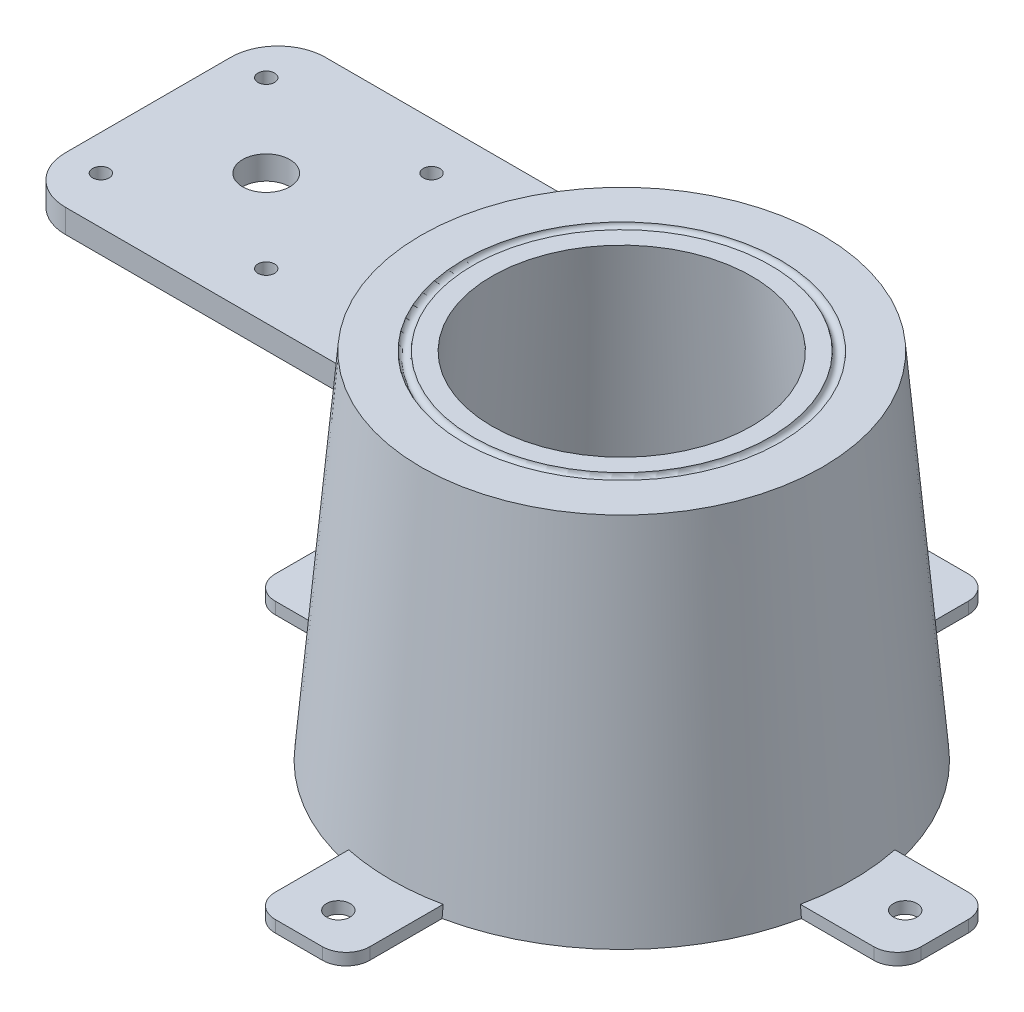
from build123d import *

# Parameters (mm, degrees)
SKETCH1_R            = 85
BOSS_EXTRUDE1_DEPTH  = 150
BOSS_EXTRUDE1_DRAFT  = 5
CUT_SWEEP1_PROFILE_R = 2
SKETCH11_R           = 55
CUT_EXTRUDE1_DEPTH   = 150
CUT_EXTRUDE1_DRAFT   = 5
BOSS_EXTRUDE2_START  = -10
SKETCH13_W           = 140
SKETCH13_H           = 110
BOSS_EXTRUDE2_DEPTH  = 10
SKETCH14_R           = 10
CUT_EXTRUDE2_DEPTH   = 10
FILLET3_R            = 20
SKETCH15_R           = 3.5
CUT_EXTRUDE3_DEPTH   = 10
SKETCH17_R           = 5
BOSS_EXTRUDE3_DEPTH  = 5
CIRPATTERN1_COUNT    = 4


with BuildPart() as part:
    # Sketch1 → Boss-Extrude1 (with draft: the straight prism first)
    with BuildSketch(Plane(origin=(0, 0, 0), x_dir=(1, 0, 0), z_dir=(0, 1, 0))):
        Circle(SKETCH1_R)
    extrude(amount=-BOSS_EXTRUDE1_DEPTH)
    # Boss-Extrude1: the draft: its side faces are tilted about the plane it starts from
    boss_extrude1_sides = [part.faces().sort_by_distance(p)[0] for p in [
        (-85, -75, 0),
    ]]
    draft(boss_extrude1_sides, Plane(origin=(0, 0, 0), x_dir=(1, 0, 0), z_dir=(0, 1, 0)), BOSS_EXTRUDE1_DRAFT)

    # Cut-Sweep1: sweep along a path in Sketch2
    with BuildLine(Plane(origin=(0, 0, 0), x_dir=(1, 0, 0), z_dir=(0, 1, 0))) as cut_sweep1_path:
        CenterArc((0, 0), 65, 0, 360)
    # Cut-Sweep1 profile (on start of the path) → Cut-Sweep1 (sweep, cut)
    with BuildSketch(Plane(origin=(65, 0, 0), x_dir=(-1, 0, 0), z_dir=(0, 0, -1))):
        Circle(CUT_SWEEP1_PROFILE_R)
    sweep(path=cut_sweep1_path.line, mode=Mode.SUBTRACT)


with BuildPart() as cut_extrude1_tool:
    # Sketch11 → Cut-Extrude1 (with draft: the straight prism first)
    with BuildSketch(Plane(origin=(0, 0, 0), x_dir=(1, 0, 0), z_dir=(0, 1, 0))):
        Circle(SKETCH11_R)
    extrude(amount=-CUT_EXTRUDE1_DEPTH)
    # Cut-Extrude1: the draft: its side faces are tilted about the plane it starts from
    cut_extrude1_sides = [cut_extrude1_tool.faces().sort_by_distance(p)[0] for p in [
        (-55, -75, 0),
    ]]
    draft(cut_extrude1_sides, Plane(origin=(0, 0, 0), x_dir=(1, 0, 0), z_dir=(0, 1, 0)), CUT_EXTRUDE1_DRAFT)


with BuildPart() as part_1:
    add(part.part)

    # Cut-Extrude1: cut by cut_extrude1_tool
    add(cut_extrude1_tool.part, mode=Mode.SUBTRACT)

    # Sketch13 → Boss-Extrude2 (add)
    with BuildSketch(Plane(origin=(0, 0, 0), x_dir=(1, 0, 0), z_dir=(0, 1, 0)).offset(BOSS_EXTRUDE2_START)):
        with Locations((-130.53, 0)):
            Rectangle(SKETCH13_W, SKETCH13_H)
    extrude(amount=-BOSS_EXTRUDE2_DEPTH)

    # Sketch14 → Cut-Extrude2 (cut)
    with BuildSketch(Plane(origin=(0, -10, 0), x_dir=(1, 0, 0), z_dir=(0, 1, 0))):
        with Locations(Location((-150.53, 0, 0), (0, 0, 270))):
            Circle(SKETCH14_R)
    extrude(amount=-CUT_EXTRUDE2_DEPTH, mode=Mode.SUBTRACT)

    # Fillet3
    fillet3_edges = [part_1.edges().sort_by_distance(p)[0] for p in [
        (-200.53, -15, 55),
        (-200.53, -15, -55),
    ]]
    fillet(fillet3_edges, radius=FILLET3_R)

    # Sketch15 → Cut-Extrude3 (cut)
    with BuildSketch(Plane(origin=(0, -10, 0), x_dir=(1, 0, 0), z_dir=(0, 1, 0))):
        with Locations(Location((-185.53, 35, 0), (0, 0, 270))):
            Circle(SKETCH15_R)
        with Locations(Location((-115.53, 35, 0), (0, 0, 270))):
            Circle(SKETCH15_R)
        with Locations(Location((-115.53, -35, 0), (0, 0, 270))):
            Circle(SKETCH15_R)
        with Locations(Location((-185.53, -35, 0), (0, 0, 270))):
            Circle(SKETCH15_R)
    extrude(amount=-CUT_EXTRUDE3_DEPTH, mode=Mode.SUBTRACT)

    # Sketch17 → Boss-Extrude3 (add)
    with BuildSketch(Plane.XZ.offset(150)):
        with BuildLine():
            Line((-10, 136.694847673), (10, 136.694847673))
            ThreePointArc((10, 136.694847673), (17.071067812, 133.765915485), (20, 126.694847673))
            Line((20, 126.694847673), (20, 82.304982624))
            Line((20, 82.304982624), (-20, 82.304982624))
            Line((-20, 82.304982624), (-20, 126.694847673))
            ThreePointArc((-20, 126.694847673), (-17.071067812, 133.765915485), (-10, 136.694847673))
        make_face()
        with Locations(Location((0, 120, 0), (0, 0, 270))):
            Circle(SKETCH17_R, mode=Mode.SUBTRACT)
    boss_extrude3 = extrude(amount=-BOSS_EXTRUDE3_DEPTH)

    # CirPattern1: Boss-Extrude3 ×4 about axis
    cirpattern1_axis = Axis((0, 0, 0), (0, 1, 0))
    for i in range(1, CIRPATTERN1_COUNT):
        add(boss_extrude3.rotate(cirpattern1_axis, i * 360 / CIRPATTERN1_COUNT))


solid = part_1.part
